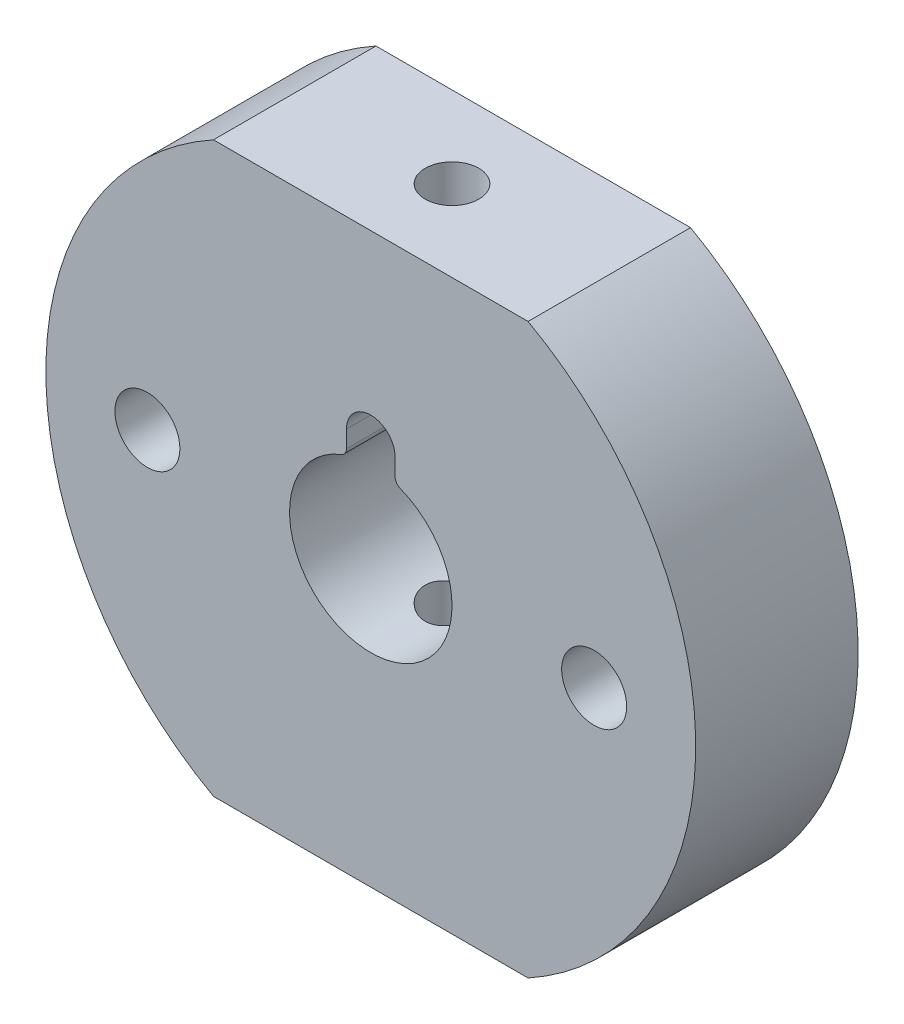
from build123d import *

# Parameters (mm, degrees)
SKETCH_1_R               = 20
SKETCH_1_R_2             = 5
SKETCH_1_R_3             = 1.9999999999999996
SKETCH_1_R_4             = 2.0000000000000013
EXTRUDE_1_DEPTH          = 10
CUT_EXTRUDE_1_DEPTH      = 31
CUT_EXTRUDE_1_DEPTH_BACK = 31
SKETCH_2_R               = 1.6500000000000001
CUT_EXTRUDE_2_DEPTH      = 31.00000018509541
CUT_EXTRUDE_3_DEPTH      = 31.00000018509541
FILLET_1_R               = 0.5


with BuildPart() as part:
    # ｽｹｯﾁ1 → ﾎﾞｽ - 押し出し1 (new body)
    with BuildSketch(Plane.XY):
        Circle(SKETCH_1_R)
        Circle(SKETCH_1_R_2, mode=Mode.SUBTRACT)
        with Locations((-13.75, 0)):
            Circle(SKETCH_1_R_3, mode=Mode.SUBTRACT)
        with Locations((13.75, 0)):
            Circle(SKETCH_1_R_4, mode=Mode.SUBTRACT)
    extrude(amount=EXTRUDE_1_DEPTH)

    # ｽｹｯﾁ2 → ｶｯﾄ - 押し出し1 (cut, two sides: drawn at the far end of the back side and taken through both)
    with BuildSketch(Plane(origin=(0, 0, 0), x_dir=(1, 0, 0), z_dir=(0, 1, 0)).offset(-CUT_EXTRUDE_1_DEPTH_BACK)):
        with Locations(Location((0, -5, 0), (0, 0, 270))):
            Circle(SKETCH_2_R)
    extrude(amount=CUT_EXTRUDE_1_DEPTH + CUT_EXTRUDE_1_DEPTH_BACK, mode=Mode.SUBTRACT)

    # ｽｹｯﾁ3 → ｶｯﾄ - 押し出し2 (cut, through all)
    with BuildSketch(Plane.XY.offset(10)):
        with BuildLine():
            ThreePointArc((-0.8423325125714249, 4.928536896307575), (-0.42267926283542223, 4.982102190919903), (-8.296e-14, 5))
            Line((0, 5), (0, 6.169696007084729))
            Line((0, 6.169696007084729), (-1.5, 6.169696007084729))
            ThreePointArc((-1.5000000000000002, 6.169696007084729), (-1.3254242280977697, 5.4673779768652055), (-0.8423325125714237, 4.928536896307585))
        make_face()
        with BuildLine():
            Line((0, 6.169696007084729), (0, 5))
            ThreePointArc((-8.296e-14, 5), (0.42267926283533985, 4.982102190919911), (0.8423325125714245, 4.928536896307575))
            ThreePointArc((0.8423325125714223, 4.928536896307583), (1.325424228097769, 5.467377976865205), (1.5000000000000002, 6.169696007084729))
            Line((1.5, 6.169696007084729), (0, 6.169696007084729))
        make_face()
        with BuildLine():
            Line((-1.5, 6.169696007084729), (0, 6.169696007084729))
            Line((0, 6.169696007084729), (0, 7.669696007084729))
            ThreePointArc((1.974e-14, 7.669696007084729), (-1.0606601717798143, 7.230356178864558), (-1.5000000000000002, 6.169696007084729))
        make_face()
        with BuildLine():
            Line((0, 7.669696007084729), (0, 6.169696007084729))
            Line((0, 6.169696007084729), (1.5, 6.169696007084729))
            ThreePointArc((1.5000000000000002, 6.169696007084729), (1.0606601717798283, 7.230356178864544), (1.941e-14, 7.669696007084729))
        make_face()
        with BuildLine():
            Line((-1.5, 6.169696007084729), (0, 6.169696007084729))
            Line((0, 6.169696007084729), (0, 7.669696007084729))
            ThreePointArc((1.974e-14, 7.669696007084729), (-1.0606601717798143, 7.230356178864558), (-1.5000000000000002, 6.169696007084729))
        make_face()
        with BuildLine():
            Line((0, 7.669696007084729), (0, 6.169696007084729))
            Line((0, 6.169696007084729), (1.5, 6.169696007084729))
            ThreePointArc((1.5000000000000002, 6.169696007084729), (1.0606601717798283, 7.230356178864544), (1.941e-14, 7.669696007084729))
        make_face()
        with BuildLine():
            ThreePointArc((0.8423325125714245, 4.928536896307575), (1.173856041806049, 4.860253284872655), (1.4999999999999996, 4.769696007084728))
            Line((1.5, 4.769696007084729), (1.5, 6.169696007084729))
            ThreePointArc((1.5000000000000002, 6.169696007084729), (1.325424228097769, 5.467377976865205), (0.8423325125714223, 4.928536896307583))
        make_face()
        with BuildLine():
            ThreePointArc((-0.8423325125714249, 4.928536896307575), (-0.42267926283542223, 4.982102190919903), (-8.296e-14, 5))
            Line((0, 5), (0, 6.169696007084729))
            Line((0, 6.169696007084729), (-1.5, 6.169696007084729))
            ThreePointArc((-1.5000000000000002, 6.169696007084729), (-1.3254242280977697, 5.4673779768652055), (-0.8423325125714237, 4.928536896307585))
        make_face()
        with BuildLine():
            Line((0, 6.169696007084729), (0, 5))
            ThreePointArc((-8.296e-14, 5), (0.42267926283533985, 4.982102190919911), (0.8423325125714245, 4.928536896307575))
            ThreePointArc((0.8423325125714223, 4.928536896307583), (1.325424228097769, 5.467377976865205), (1.5000000000000002, 6.169696007084729))
            Line((1.5, 6.169696007084729), (0, 6.169696007084729))
        make_face()
        with BuildLine():
            Line((-1.5, 6.169696007084729), (-1.5, 4.769696007084729))
            ThreePointArc((-1.5, 4.769696007084728), (-1.1738560418060509, 4.8602532848726545), (-0.8423325125714249, 4.928536896307575))
            ThreePointArc((-0.8423325125714237, 4.928536896307585), (-1.3254242280977697, 5.4673779768652055), (-1.5000000000000002, 6.169696007084729))
        make_face()
    extrude(amount=-CUT_EXTRUDE_2_DEPTH, mode=Mode.SUBTRACT)

    # ｽｹｯﾁ4 → ｶｯﾄ - 押し出し3 (cut, through all)
    with BuildSketch(Plane.XY.offset(10)):
        with BuildLine():
            ThreePointArc((9.68245836551855, 17.499999999999996), (1.22e-15, 20), (-9.682458365518547, 17.499999999999996))
            Line((-9.682458365518546, 17.499999999999996), (9.68245836551855, 17.499999999999996))
        make_face()
        with BuildLine():
            Line((9.68245836551855, -17.499999999999996), (-9.682458365518546, -17.499999999999996))
            ThreePointArc((-9.682458365518551, -17.499999999999996), (-3.67e-15, -20), (9.682458365518546, -17.499999999999996))
        make_face()
    extrude(amount=-CUT_EXTRUDE_3_DEPTH, mode=Mode.SUBTRACT)

    # ﾌｨﾚｯﾄ1
    fillet_1_edges = [part.edges().sort_by_distance(p)[0] for p in [
        (1.4999999999999998, 4.769696007084728, 7.843693197647017),
        (-1.5, 4.769696007084729, 7.843693197355676),
    ]]
    fillet(fillet_1_edges, radius=FILLET_1_R)


solid = part.part
